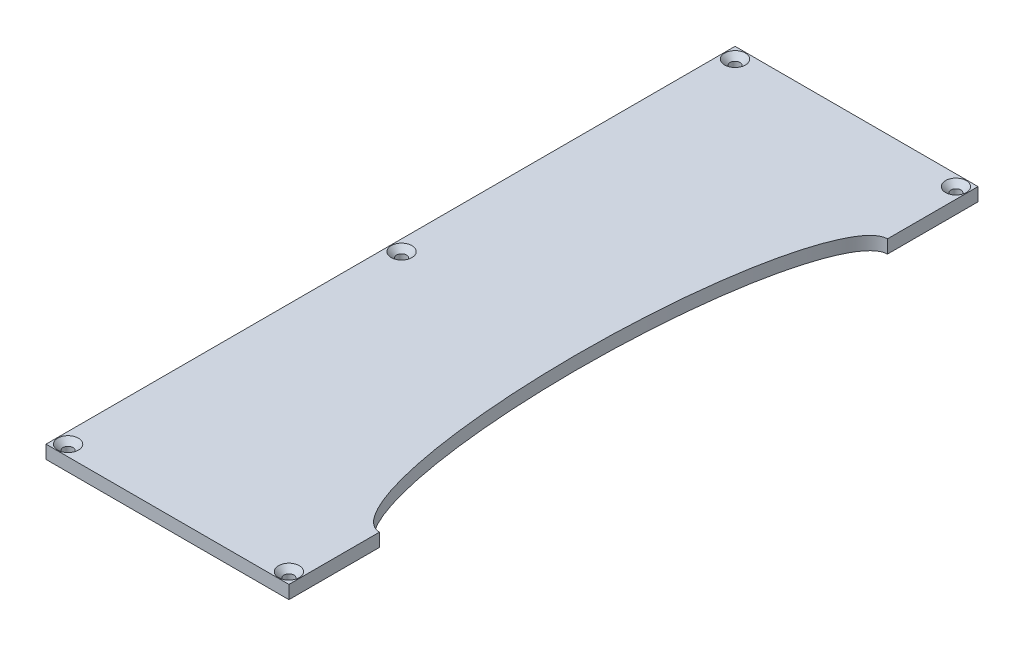
from build123d import *

# Parameters (mm, degrees)
BOSS_EXTRUDE1_DEPTH                                 = 6
CSK_FOR_M4_COUNTERSUNK_FLAT_HEAD_SCREW1_D           = 4.5
CSK_FOR_M4_COUNTERSUNK_FLAT_HEAD_SCREW1_DEPTH       = 10
CSK_FOR_M4_COUNTERSUNK_FLAT_HEAD_SCREW1_CSINK_D     = 9.4
CSK_FOR_M4_COUNTERSUNK_FLAT_HEAD_SCREW1_CSINK_ANGLE = 90
CSK_FOR_M4_COUNTERSUNK_FLAT_HEAD_SCREW1_TIP         = 1.351936393


with BuildPart() as part:
    # Sketch1 → Boss-Extrude1 (new body)
    with BuildSketch(Plane(origin=(0, 0, 0), x_dir=(1, 0, 0), z_dir=(0, 1, 0))):
        with BuildLine():
            add(Edge.make_bspline(
                [(0, 115), (-25, 115), (-25, 0), (-25, -115), (0, -115)],
                knots=[0, 0, 0, 1.570796327, 1.570796327, 3.141592654, 3.141592654, 3.141592654], degree=2, weights=[1, 0.707106781, 1, 0.707106781, 1]))
            Line((0, 115), (0, 156))
            Line((0, 156), (-110, 156))
            Line((-110, 156), (-110, -156))
            Line((-110, -156), (0, -156))
            Line((0, -156), (0, -115))
        make_face()
    extrude(amount=BOSS_EXTRUDE1_DEPTH)

    # CSK for M4 Countersunk Flat Head Screw1
    with Locations(Plane(origin=(0, 6, 0), x_dir=(1, 0, 0), z_dir=(0, 1, 0))):
        with Locations((-105, 151), (-5, 151), (-5, -151), (-105, -151), (-105, 0)):
            CounterSinkHole(CSK_FOR_M4_COUNTERSUNK_FLAT_HEAD_SCREW1_D / 2, CSK_FOR_M4_COUNTERSUNK_FLAT_HEAD_SCREW1_CSINK_D / 2, depth=CSK_FOR_M4_COUNTERSUNK_FLAT_HEAD_SCREW1_DEPTH, counter_sink_angle=CSK_FOR_M4_COUNTERSUNK_FLAT_HEAD_SCREW1_CSINK_ANGLE)
            with Locations((0, 0, -(CSK_FOR_M4_COUNTERSUNK_FLAT_HEAD_SCREW1_DEPTH + CSK_FOR_M4_COUNTERSUNK_FLAT_HEAD_SCREW1_TIP / 2))):  # 118° drill point
                Cone(0, CSK_FOR_M4_COUNTERSUNK_FLAT_HEAD_SCREW1_D / 2, CSK_FOR_M4_COUNTERSUNK_FLAT_HEAD_SCREW1_TIP, mode=Mode.SUBTRACT)


solid = part.part
